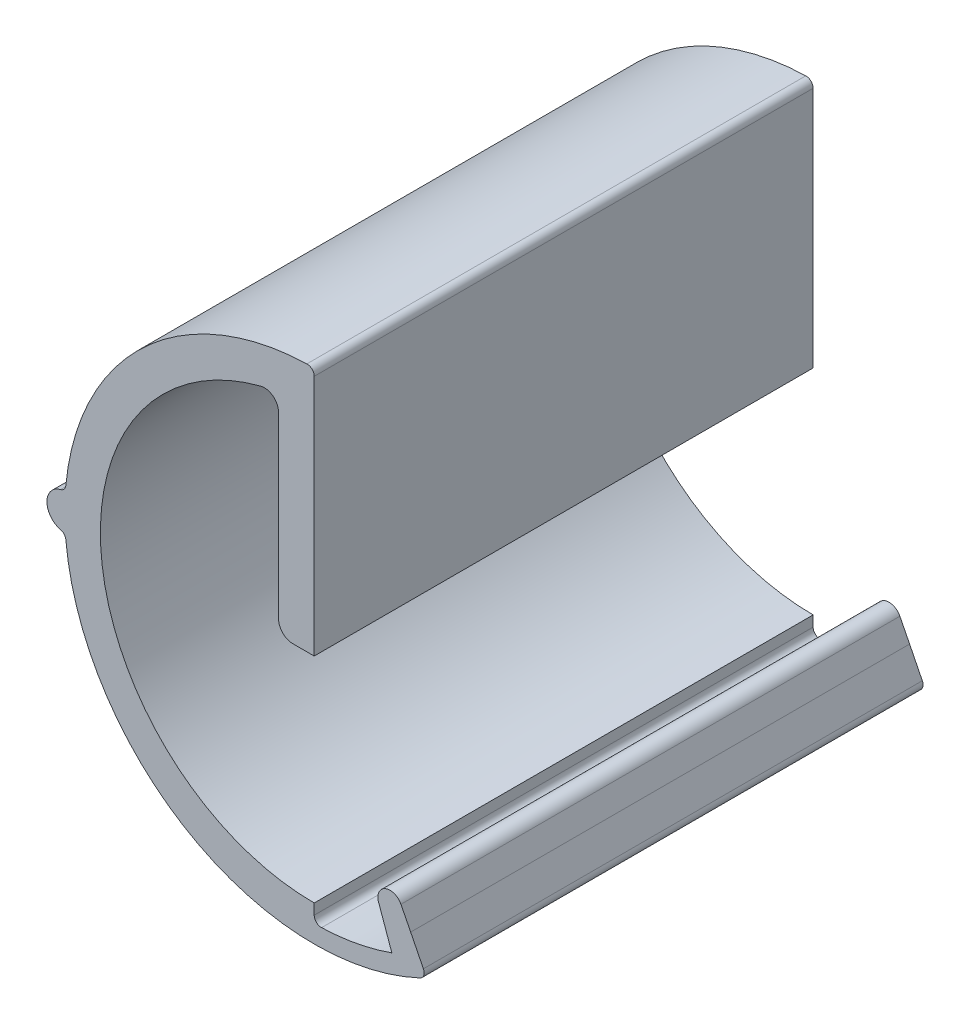
from build123d import *

# Parameters (mm, degrees)
BOSS_EXTRUDE1_DEPTH = 70
FILLET1_R           = 2
FILLET2_R           = 2
FILLET3_R           = 1
FILLET4_R           = 1
FILLET5_R           = 1
FILLET6_R           = 1


with BuildPart() as part:
    # Sketch1 → Boss-Extrude1 (new body)
    with BuildSketch(Plane.XY):
        with BuildLine():
            Line((0, 35), (0, 0))
            Line((0, 0), (-5, 0))
            Line((-5, 0), (-5, 29.580398915))
            ThreePointArc((-5, 29.580398915), (-29.894915684, -2.508787808), (0, -30))
            Line((0, -30), (0, -32.5))
            ThreePointArc((0, -32.5), (5.527213221, -32.026550142), (10.893389008, -30.619994708))
            Line((10.893389008, -30.619994708), (9.114585792, -25.619994708))
            ThreePointArc((9.114585792, -25.619994708), (9.870035541, -23.320104454), (12.169925795, -24.075554203))
            Line((12.169925795, -24.075554203), (13.533846284, -26.773774571))
            Line((13.533846284, -26.773774571), (15.771374385, -31.245219635))
            ThreePointArc((15.771374385, -31.245219635), (-17.267698729, -30.443826642), (-34.910714286, -2.498405104))
            ThreePointArc((-34.910714286, -2.498405104), (-37.5, 0), (-34.910714286, 2.498405104))
            ThreePointArc((-34.910714286, 2.498405104), (-23.849065195, 25.616832148), (0, 35))
        make_face()
    extrude(amount=-BOSS_EXTRUDE1_DEPTH)

    # Fillet1
    fillet1_edges = [part.edges().sort_by_distance(p)[0] for p in [
        (-5, 0, -35),
    ]]
    fillet(fillet1_edges, radius=FILLET1_R)

    # Fillet2
    fillet2_edges = [part.edges().sort_by_distance(p)[0] for p in [
        (-5, 29.580398915, -35),
    ]]
    fillet(fillet2_edges, radius=FILLET2_R)

    # Fillet3
    fillet3_edges = [part.edges().sort_by_distance(p)[0] for p in [
        (0, -32.5, -35),
    ]]
    fillet(fillet3_edges, radius=FILLET3_R)

    # Fillet4
    fillet4_edges = [part.edges().sort_by_distance(p)[0] for p in [
        (15.771374385, -31.245219635, -35),
    ]]
    fillet(fillet4_edges, radius=FILLET4_R)

    # Fillet5
    fillet5_edges = [part.edges().sort_by_distance(p)[0] for p in [
        (-34.910714286, -2.498405104, -35),
        (-34.910714286, 2.498405104, -35),
    ]]
    fillet(fillet5_edges, radius=FILLET5_R)

    # Fillet6
    fillet6_edges = [part.edges().sort_by_distance(p)[0] for p in [
        (0, 35, -35),
    ]]
    fillet(fillet6_edges, radius=FILLET6_R)


solid = part.part
